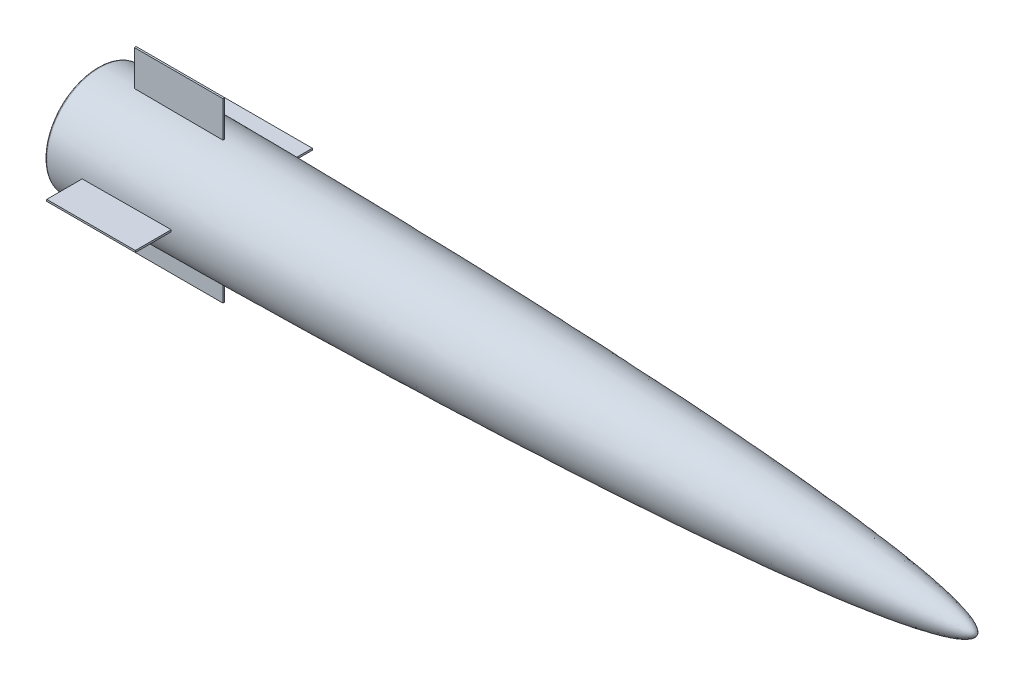
from build123d import *

# Parameters (mm, degrees)
FIN_SKETCH_W      = 100
FIN_SKETCH_H      = 100
FIN_EXTRUDE_DEPTH = 1
FIN_PATTERN_COUNT = 4


with BuildPart() as part:
    # body sketch → body revolve (revolve)
    with BuildSketch(Plane(origin=(0, 0, 0), x_dir=(0, 1, 0), z_dir=(0, 0, 1))):
        with BuildLine():
            Line((0, 1000), (0, 0))
            add(Edge.make_bspline(
                [(0, 0), (60, 0), (60, 990)],
                knots=[3.141592654, 3.141592654, 3.141592654, 4.71238898, 4.71238898, 4.71238898], degree=2, weights=[1, 0.707106781, 1]))
            add(Edge.make_bspline(
                [(60, 990), (60, 1000), (0, 1000)],
                knots=[0, 0, 0, 1.570796327, 1.570796327, 1.570796327], degree=2, weights=[1, 0.707106781, 1]))
        make_face()
    revolve(axis=Axis((-1000, 0, 0), (1, 0, 0)))

    # fin sketch → fin extrude (add, symmetric)
    with BuildSketch(Plane(origin=(0, 0, 0), x_dir=(0, 1, 0), z_dir=(0, 0, 1))):
        with Locations((50, 900)):
            Rectangle(FIN_SKETCH_W, FIN_SKETCH_H)
    fin_extrude = extrude(amount=FIN_EXTRUDE_DEPTH, both=True)

    # fin pattern: fin extrude ×4 about axis
    fin_pattern_axis = Axis((0, 0, 0), (-1, 0, 0))
    for i in range(1, FIN_PATTERN_COUNT):
        add(fin_extrude.rotate(fin_pattern_axis, i * 360 / FIN_PATTERN_COUNT))


solid = part.part
